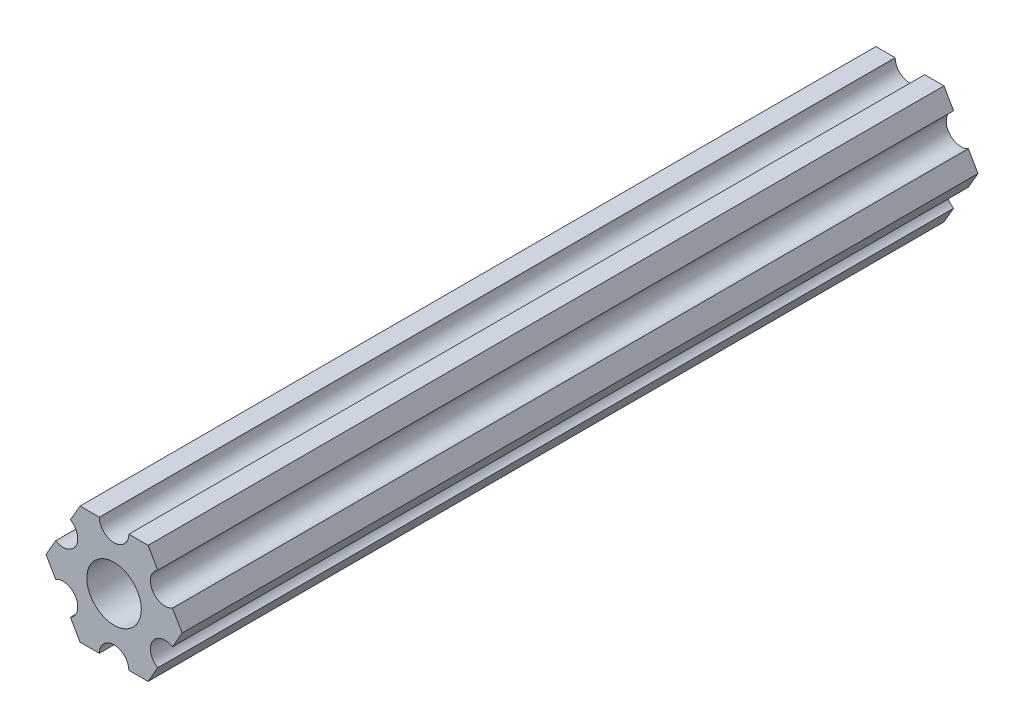
from build123d import *

# Parameters (mm, degrees)
SKETCH1_R           = 2.9337
BOSS_EXTRUDE1_DEPTH = 85.725


with BuildPart() as part:
    # Sketch1 → Boss-Extrude1 (new body)
    with BuildSketch(Plane(origin=(0, 0, 0), x_dir=(-1, 0, 0), z_dir=(0, 0, -1))):
        with BuildLine():
            Line((-4.70551159, -4.549815043), (-3.666174521, -6.349999904))
            Line((-3.666174521, -6.349999904), (-1.587500385, -6.349999904))
            ThreePointArc((-1.587500385, -6.349999904), (-3.85e-07, -4.762499904), (1.587499615, -6.349999904))
            Line((1.587499615, -6.349999904), (3.666173825, -6.349999904))
            Line((3.666173825, -6.349999904), (4.705510942, -4.54981524))
            ThreePointArc((4.705510942, -4.54981524), (4.124445629, -2.381249907), (6.293010962, -1.800184594))
            Line((6.293010962, -1.800184594), (7.332348079, 7e-08))
            Line((7.332348079, 7e-08), (6.293011217, 1.800184685))
            ThreePointArc((6.293011217, 1.800184685), (4.124445939, 2.381250203), (4.705511457, 4.549815481))
            Line((4.705511457, 4.549815481), (3.666174521, 6.350000222))
            Line((3.666174521, 6.350000222), (1.587500385, 6.350000222))
            ThreePointArc((1.587500385, 6.350000222), (3.85e-07, 4.762500222), (-1.587499615, 6.350000222))
            Line((-1.587499615, 6.350000222), (-3.666173825, 6.350000222))
            Line((-3.666173825, 6.350000222), (-4.705511038, 4.549815614))
            ThreePointArc((-4.705511038, 4.549815614), (-4.124445841, 2.38125025), (-6.293011205, 1.800185053))
            Line((-6.293011205, 1.800185053), (-7.332348419, 4.44e-07))
            Line((-7.332348419, 4.44e-07), (-6.293011423, -1.80018429))
            ThreePointArc((-6.293011423, -1.80018429), (-4.12444613, -2.38124975), (-4.70551159, -4.549815043))
        make_face()
        with Locations(Location((0, 0, 0), (0, 0, 180))):
            Circle(SKETCH1_R, mode=Mode.SUBTRACT)
    extrude(amount=-BOSS_EXTRUDE1_DEPTH)


solid = part.part
